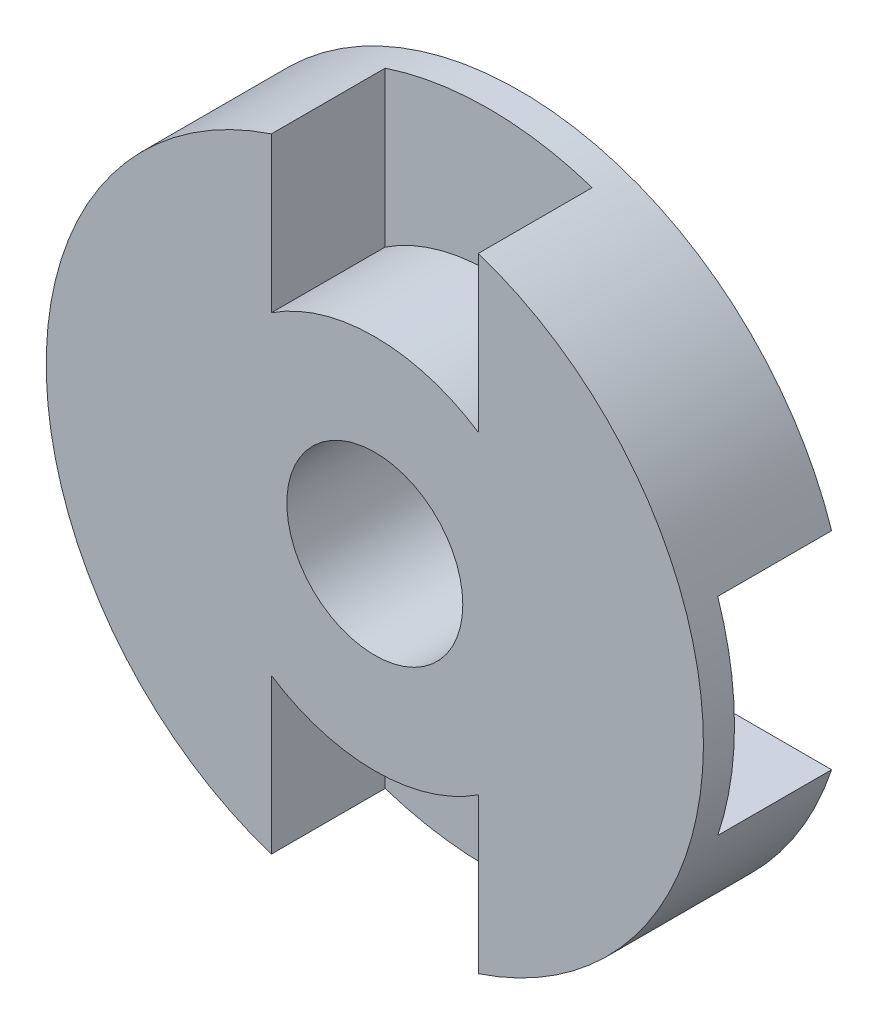
from build123d import *

# Parameters (mm, degrees)
SKETCH1_R                       = 6.35
BOSS_EXTRUDE1_DEPTH             = 1.4
SKETCH2_W                       = 4
SKETCH2_H                       = 12.7
CUT_EXTRUDE1_DEPTH              = 2.2
SKETCH3_W                       = 12.7
SKETCH3_H                       = 4
CUT_EXTRUDE2_DEPTH              = 2.2
BOSS_EXTRUDE2_REACH             = 11.246
SKETCH9_R                       = 3.633
SKETCH9_R_2                     = 1.7
BOSS_EXTRUDE2_DIRECTION_2_REACH = 11.246


with BuildPart() as part:
    # Sketch1 → Boss-Extrude1 (new, symmetric)
    with BuildSketch(Plane.XY):
        Circle(SKETCH1_R)
    extrude(amount=BOSS_EXTRUDE1_DEPTH, both=True)

    # Sketch2 → Cut-Extrude1 (cut)
    with BuildSketch(Plane.XY.offset(1.4)):
        Rectangle(SKETCH2_W, SKETCH2_H)
    extrude(amount=-CUT_EXTRUDE1_DEPTH, mode=Mode.SUBTRACT)

    # Sketch3 → Cut-Extrude2 (cut)
    with BuildSketch(Plane(origin=(0, 0, -1.4), x_dir=(-1, 0, 0), z_dir=(0, 0, -1))):
        Rectangle(SKETCH3_W, SKETCH3_H)
    extrude(amount=-CUT_EXTRUDE2_DEPTH, mode=Mode.SUBTRACT)

    # Boss-Extrude2: up to this face of the body (flat: up to its plane)
    boss_extrude2_end = Plane(part.part.faces().sort_by_distance((-3.803983963, 0, 1.4))[0])
    # Sketch9 → Boss-Extrude2 (add, up to the picked face)
    with BuildSketch(Plane.XY.offset(-0.8), mode=Mode.PRIVATE) as boss_extrude2_sk1:
        Circle(SKETCH9_R)
        Circle(SKETCH9_R_2, mode=Mode.SUBTRACT)
    boss_extrude2_tool1 = split(extrude(boss_extrude2_sk1.sketch, amount=BOSS_EXTRUDE2_REACH, mode=Mode.PRIVATE), bisect_by=boss_extrude2_end, keep=Keep.BOTH, mode=Mode.PRIVATE)
    add(boss_extrude2_tool1.solids().sort_by(Axis((-3.530243, 0, -0.8), (0, 0, 1)))[0])

    # Boss-Extrude2 direction 2: up to this face of the body (flat: up to its plane)
    boss_extrude2_direction_2_end = Plane(part.part.faces().sort_by_distance((0, 3.803983963, -1.4))[0])
    # Sketch9 → Boss-Extrude2 direction 2 (add, up to the picked face)
    with BuildSketch(Plane.XY.offset(-0.8), mode=Mode.PRIVATE) as boss_extrude2_direction_2_sk1:
        Circle(SKETCH9_R)
        Circle(SKETCH9_R_2, mode=Mode.SUBTRACT)
    boss_extrude2_direction_2_tool1 = split(extrude(boss_extrude2_direction_2_sk1.sketch, amount=-BOSS_EXTRUDE2_DIRECTION_2_REACH, mode=Mode.PRIVATE), bisect_by=boss_extrude2_direction_2_end, keep=Keep.BOTH, mode=Mode.PRIVATE)
    add(boss_extrude2_direction_2_tool1.solids().sort_by(Axis((-3.530243, 0, -0.8), (0, 0, -1)))[0])


solid = part.part
